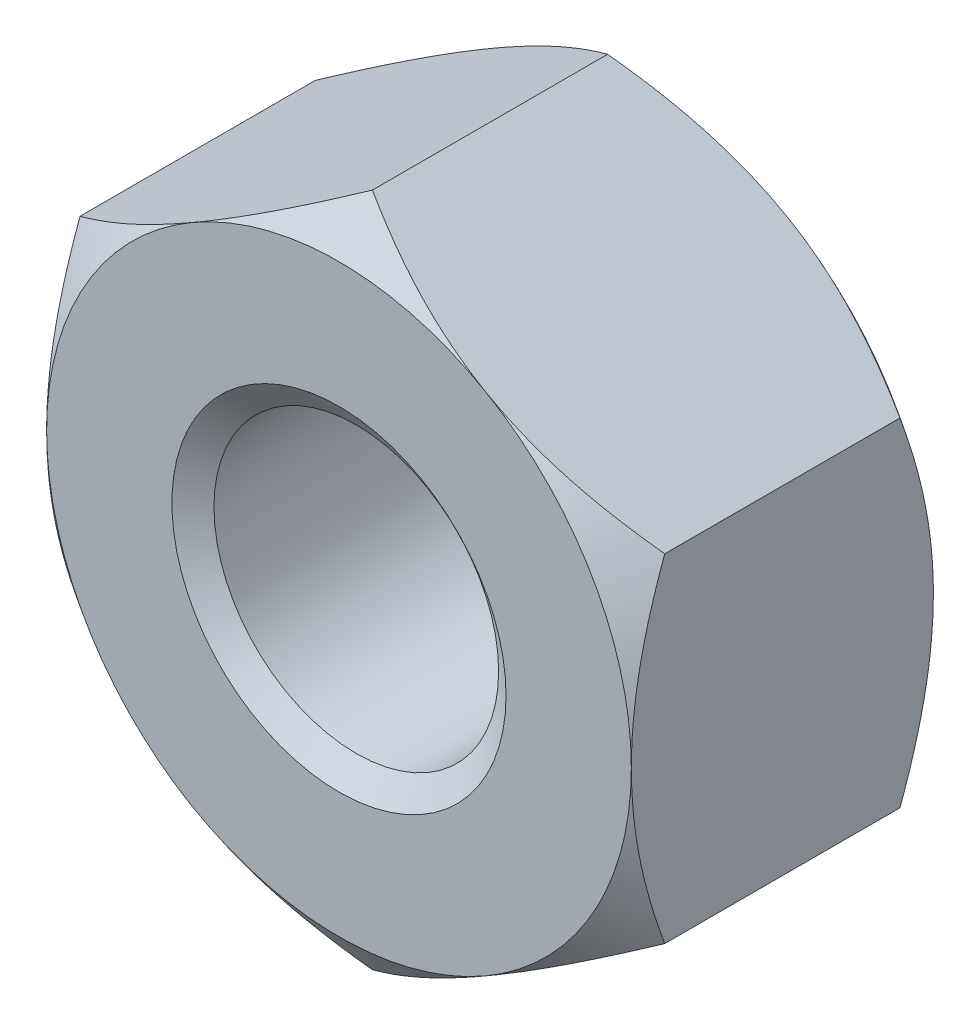
from build123d import *

# Parameters (mm, degrees)
BASENUTSKE_R  = 2.7051
BASENUT_DEPTH = 5.7404


with BuildPart() as part:
    # BaseNutSke → BaseNut (new body)
    with BuildSketch(Plane.XY):
        Polygon((5.55625, 3.207902433), (5.55625, -3.207902433), (0, -6.415804866), (-5.55625, -3.207902433), (-5.55625, 3.207902433), (0, 6.415804866), align=None)
        Circle(BASENUTSKE_R, mode=Mode.SUBTRACT)
    extrude(amount=-BASENUT_DEPTH)

    # Sketch3 → Double-Chamfer (revolve, cut)
    with BuildSketch(Plane(origin=(0, 0, 0), x_dir=(0, 0, -1), z_dir=(1, 0, 0))):
        Polygon((5.7404, 5.55625), (5.1054, 6.415804866), (5.1054, 19.115804866), (18.4404, 19.115804866), (18.4404, 5.55625), align=None)
        Polygon((0.635, 19.115804866), (-12.7, 19.115804866), (-12.7, 5.55625), (0, 5.55625), (0.635, 6.415804866), align=None)
    revolve(axis=Axis((0, 0, 0), (0, 0, -1)), mode=Mode.SUBTRACT)

    # Sketch5 (on Right Plane) → EndChamfer (revolve, cut)
    with BuildSketch(Plane(origin=(0, 0, 0), x_dir=(0, 0, -1), z_dir=(1, 0, 0)), mode=Mode.PRIVATE) as endchamfer_sk:
        Polygon((5.715, 3.175), (5.353069726, 2.65811), (5.7658, 2.65811), (5.7658, 3.175), align=None)
        Polygon((-0.0508, 3.175), (0, 3.175), (0.361930274, 2.65811), (-0.0508, 2.65811), align=None)
    revolve(endchamfer_sk.sketch.rotate(Axis((0, 0, -25.037505729), (0, 0, -1)), 90), axis=Axis((0, 0, -25.037505729), (0, 0, -1)), mode=Mode.SUBTRACT)


solid = part.part
